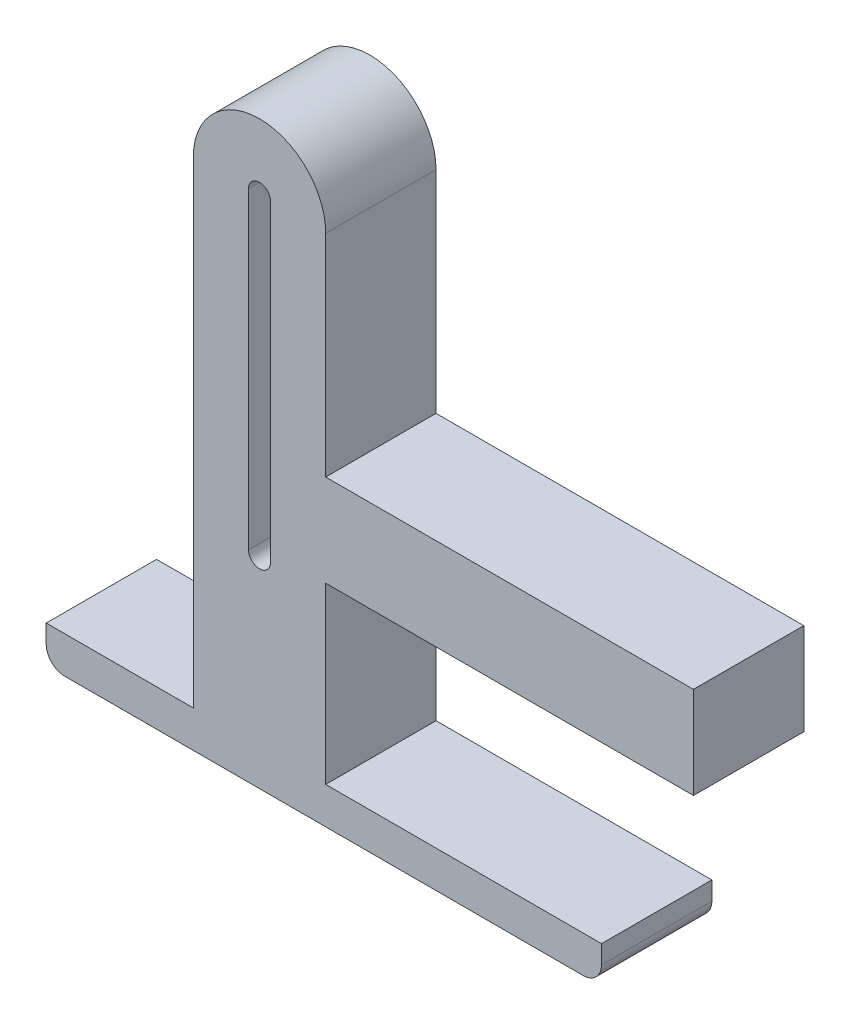
from build123d import *

# Parameters (mm, degrees)
BOSS_EXTRUDE1_DEPTH  = 6
SKETCH2_W            = 6
SKETCH2_H            = 5
BOSS_EXTRUDE2_DEPTH  = 20
EXTRUDE_1_DEPTH      = 15
EXTRUDE_1_DEPTH_BACK = 15.2
SKETCH_2_W           = 6
SKETCH_2_H           = 2
FILLET_3_R           = 1


with BuildPart() as part:
    # Sketch1 → Boss-Extrude1 (new body)
    with BuildSketch(Plane.XY):
        with BuildLine():
            Line((-3.6, 0), (-3.6, 17))
            ThreePointArc((-3.6, 17), (0, 20.6), (3.6, 17))
            Line((3.6, 17), (3.6, 0))
            Line((3.6, 0), (3.6, -10.95432829))
            Line((3.6, -10.95432829), (-3.6, -10.95432829))
            Line((-3.6, -10.95432829), (-3.6, 0))
        make_face()
        with BuildLine():
            Line((-0.6, 0), (-0.6, 17))
            ThreePointArc((-0.6, 17), (0, 17.6), (0.6, 17))
            Line((0.6, 17), (0.6, 0))
            ThreePointArc((0.6, 0), (0, -0.6), (-0.6, 0))
        make_face(mode=Mode.SUBTRACT)
    extrude(amount=BOSS_EXTRUDE1_DEPTH)

    # Sketch2 → Boss-Extrude2 (add)
    with BuildSketch(Plane(origin=(3.6, 0, 0), x_dir=(0, 0, -1), z_dir=(1, 0, 0))):
        with Locations((-3, 3.022835855)):
            Rectangle(SKETCH2_W, SKETCH2_H)
    extrude(amount=BOSS_EXTRUDE2_DEPTH)

    # Эскиз2 → Бобышка-Вытянуть1 (add, two sides: drawn at the far end of the back side and taken through both)
    with BuildSketch(Plane(origin=(3.6, 0, 0), x_dir=(0, 0, -1), z_dir=(1, 0, 0)).offset(-EXTRUDE_1_DEPTH_BACK)):
        with Locations((-3, -9.95432829)):
            Rectangle(SKETCH_2_W, SKETCH_2_H)
    extrude(amount=EXTRUDE_1_DEPTH + EXTRUDE_1_DEPTH_BACK)

    # Скругление3
    fillet_3_edges = [part.edges().sort_by_distance(p)[0] for p in [
        (-11.6, -10.95432829, 3),
        (18.6, -10.95432829, 3),
    ]]
    fillet(fillet_3_edges, radius=FILLET_3_R)


solid = part.part
